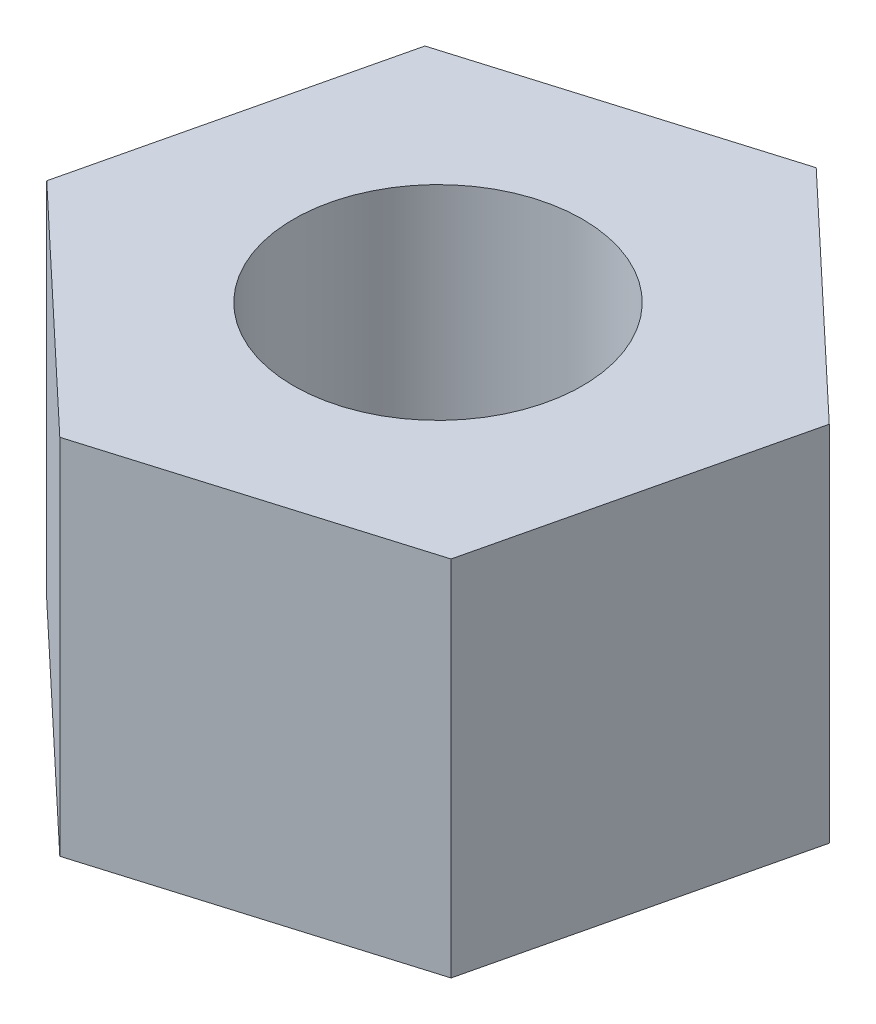
from build123d import *

# Parameters (mm, degrees)
BOSS_EXTRUDE1_DEPTH        = 6.35
F_8_0_199_DIAMETER_HOLE1_D = 5.0546


with BuildPart() as part:
    # Sketch1 → Boss-Extrude1 (new body)
    with BuildSketch(Plane(origin=(0, 0, 0), x_dir=(1, 0, 0), z_dir=(0, 1, 0))):
        Polygon((-8.892328085, 1.143201221), (-7.625793935, 6.494627783), (-11.626998209, 10.267191813), (-16.894736633, 8.688329281), (-18.161270783, 3.336902719), (-14.160066509, -0.435661311), align=None)
    extrude(amount=BOSS_EXTRUDE1_DEPTH)

    # #8 (0.199) Diameter Hole1 (through all)
    with Locations(Plane(origin=(0, 6.35, 0), x_dir=(1, 0, 0), z_dir=(0, 1, 0))):
        with Locations((-12.893532359, 4.915765251)):
            Hole(F_8_0_199_DIAMETER_HOLE1_D / 2)


solid = part.part
